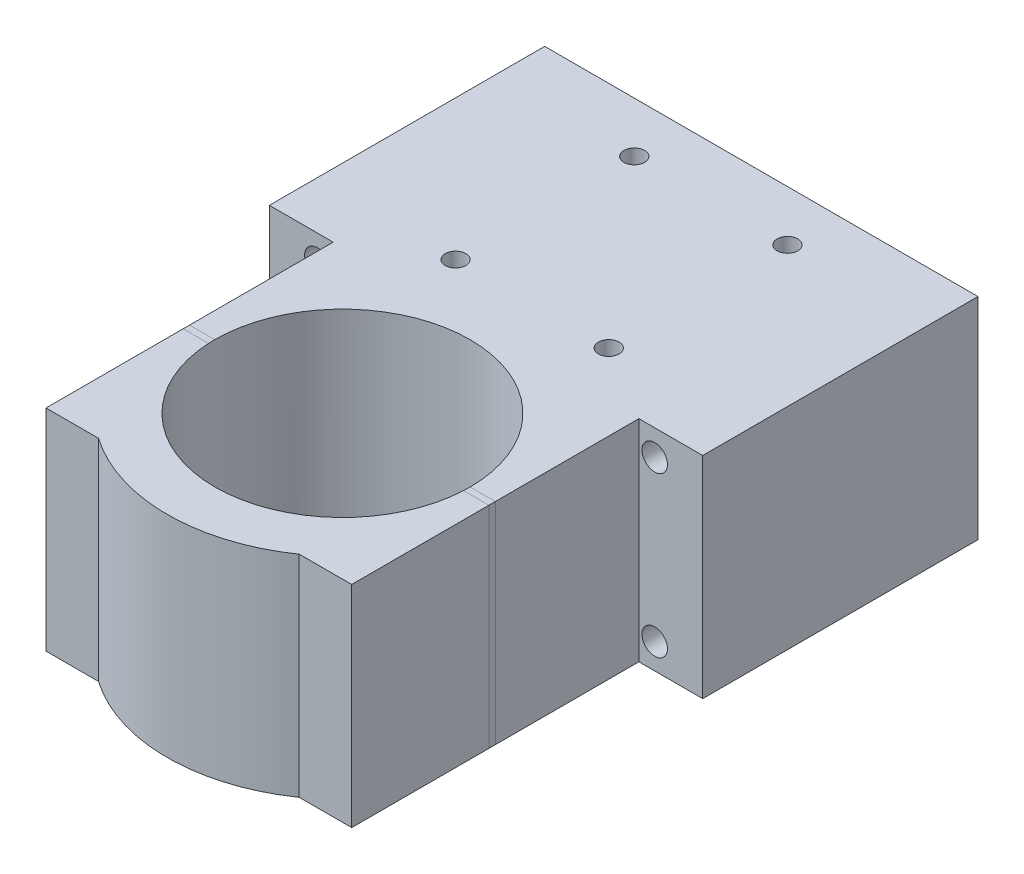
from build123d import *

# Parameters (mm, degrees)
SKETCH1_R           = 18
BOSS_EXTRUDE3_DEPTH = 33
SKETCH12_R          = 2
CUT_EXTRUDE1_DEPTH  = 10
SKETCH13_W          = 67.899494937
SKETCH13_H          = 35
BOSS_EXTRUDE4_DEPTH = 33
SKETCH14_R          = 1.62
CUT_EXTRUDE2_DEPTH  = 10
SKETCH15_R          = 20
CUT_EXTRUDE3_DEPTH  = 79.208702146


with BuildPart() as part:
    # Sketch1 → Boss-Extrude3 (new body)
    with BuildSketch(Plane(origin=(0, 0, 0), x_dir=(1, 0, 0), z_dir=(0, 1, 0))):
        with BuildLine():
            Line((-47.308295415, 17.815966111), (20.591199522, 17.815966111))
            Line((20.591199522, 17.815966111), (20.591199522, 9.675262593))
            Line((20.591199522, 9.675262593), (10.591199522, 9.675262593))
            Line((10.591199522, 9.675262593), (10.591199522, -35.324737407))
            Line((10.591199522, -35.324737407), (2.365275891, -35.324737407))
            ThreePointArc((2.365275891, -35.324737407), (-13.358547947, -40.274484875), (-29.082371784, -35.324737407))
            Line((-29.082371784, -35.324737407), (-37.308295415, -35.324737407))
            Line((-37.308295415, -35.324737407), (-37.308295415, 9.675262593))
            Line((-37.308295415, 9.675262593), (-47.308295415, 9.675262593))
            Line((-47.308295415, 9.675262593), (-47.308295415, 17.815966111))
        make_face()
        with Locations(Location((-13.358547947, -12.824737407, 0), (0, 0, 270))):
            Circle(SKETCH1_R, mode=Mode.SUBTRACT)
    extrude(amount=BOSS_EXTRUDE3_DEPTH)

    # Sketch12 → Cut-Extrude1 (cut)
    with BuildSketch(Plane(origin=(0, 0, -17.815966111), x_dir=(-1, 0, 0), z_dir=(0, 0, -1))):
        with Locations((39.788295415, 4)):
            Circle(SKETCH12_R)
        with Locations((39.788295415, 29)):
            Circle(SKETCH12_R)
        with Locations((-13.071199522, 29)):
            Circle(SKETCH12_R)
        with Locations((-13.071199522, 4)):
            Circle(SKETCH12_R)
    extrude(amount=-CUT_EXTRUDE1_DEPTH, mode=Mode.SUBTRACT)

    # Sketch13 → Boss-Extrude4 (add)
    with BuildSketch(Plane(origin=(0, 33, 0), x_dir=(1, 0, 0), z_dir=(0, 1, 0))):
        with Locations((-13.358547947, 35.315966111)):
            Rectangle(SKETCH13_W, SKETCH13_H)
    extrude(amount=-BOSS_EXTRUDE4_DEPTH)

    # Sketch14 → Cut-Extrude2 (cut)
    with BuildSketch(Plane(origin=(0, 33, 0), x_dir=(1, 0, 0), z_dir=(0, 1, 0))):
        with Locations(Location((-25.358295415, 16.899970921, 0), (0, 0, 270))):
            Circle(SKETCH14_R)
        with Locations(Location((-1.358295415, 16.899970921, 0), (0, 0, 270))):
            Circle(SKETCH14_R)
        with Locations(Location((-25.358295415, 44.899970921, 0), (0, 0, 270))):
            Circle(SKETCH14_R)
        with Locations(Location((-1.358295415, 44.899970921, 0), (0, 0, 270))):
            Circle(SKETCH14_R)
    extrude(amount=-CUT_EXTRUDE2_DEPTH, mode=Mode.SUBTRACT)

    # Sketch15 → Cut-Extrude3 (cut, through all)
    with BuildSketch(Plane.XZ):
        with Locations(Location((-13.358547947, 12.824737407, 0), (0, 0, 270))):
            Circle(SKETCH15_R)
    extrude(amount=-CUT_EXTRUDE3_DEPTH, mode=Mode.SUBTRACT)


solid = part.part
